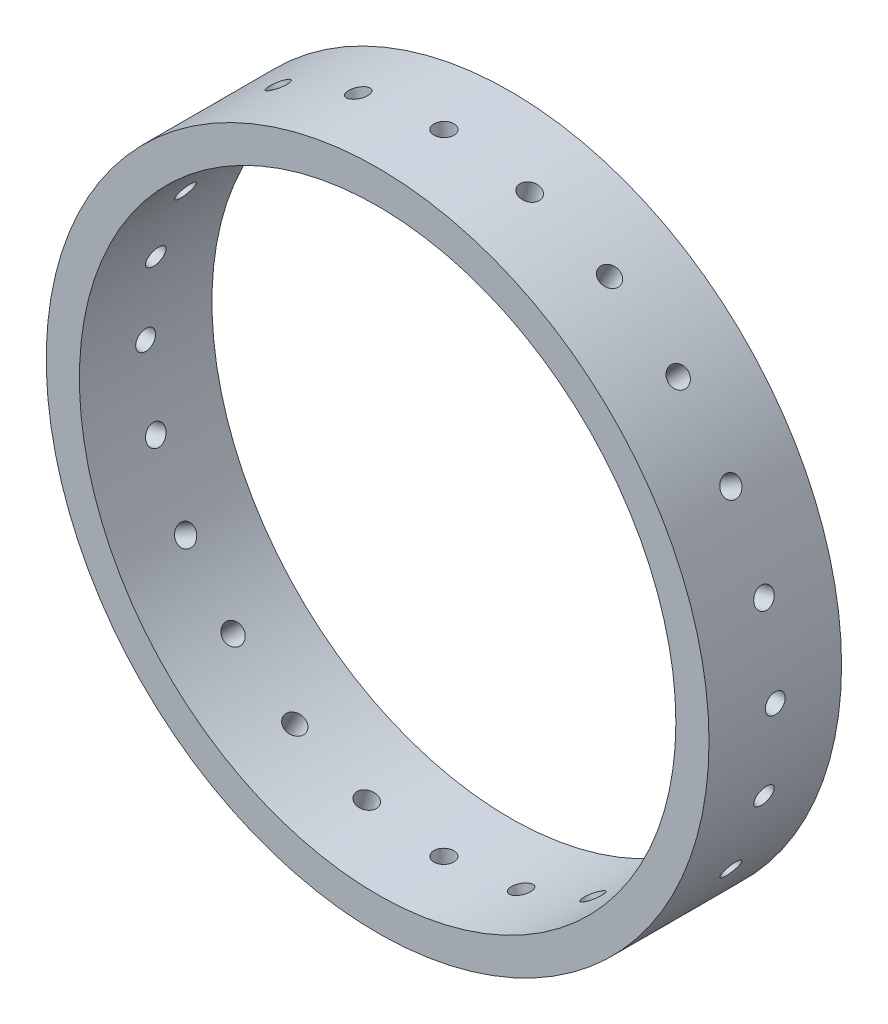
from build123d import *

# Parameters (mm, degrees)
SKETCH1_R           = 50
BOSS_EXTRUDE1_DEPTH = 10
SKETCH2_R           = 45
CUT_EXTRUDE1_DEPTH  = 20
SKETCH4_R           = 1.5
CUT_EXTRUDE2_DEPTH  = 20
CIRPATTERN1_COUNT   = 24


with BuildPart() as part:
    # Sketch1 → Boss-Extrude1 (new, symmetric)
    with BuildSketch(Plane.XY):
        Circle(SKETCH1_R)
    extrude(amount=BOSS_EXTRUDE1_DEPTH, both=True)

    # Sketch2 → Cut-Extrude1 (cut)
    with BuildSketch(Plane.XY.offset(10)):
        Circle(SKETCH2_R)
    extrude(amount=-CUT_EXTRUDE1_DEPTH, mode=Mode.SUBTRACT)

    # Sketch4 → Cut-Extrude2 (cut)
    with BuildSketch(Plane(origin=(0, 50, 0), x_dir=(1, 0, 0), z_dir=(0, 1, 0))):
        with Locations(Location((0, 0, 0), (0, 0, 270))):
            Circle(SKETCH4_R)
    cut_extrude2 = extrude(amount=-CUT_EXTRUDE2_DEPTH, mode=Mode.SUBTRACT)

    # CirPattern1: Cut-Extrude2 ×24 about axis
    cirpattern1_axis = Axis((0, 0, 10), (0, 0, -1))
    for i in range(1, CIRPATTERN1_COUNT):
        add(cut_extrude2.rotate(cirpattern1_axis, i * 360 / CIRPATTERN1_COUNT), mode=Mode.SUBTRACT)


solid = part.part
